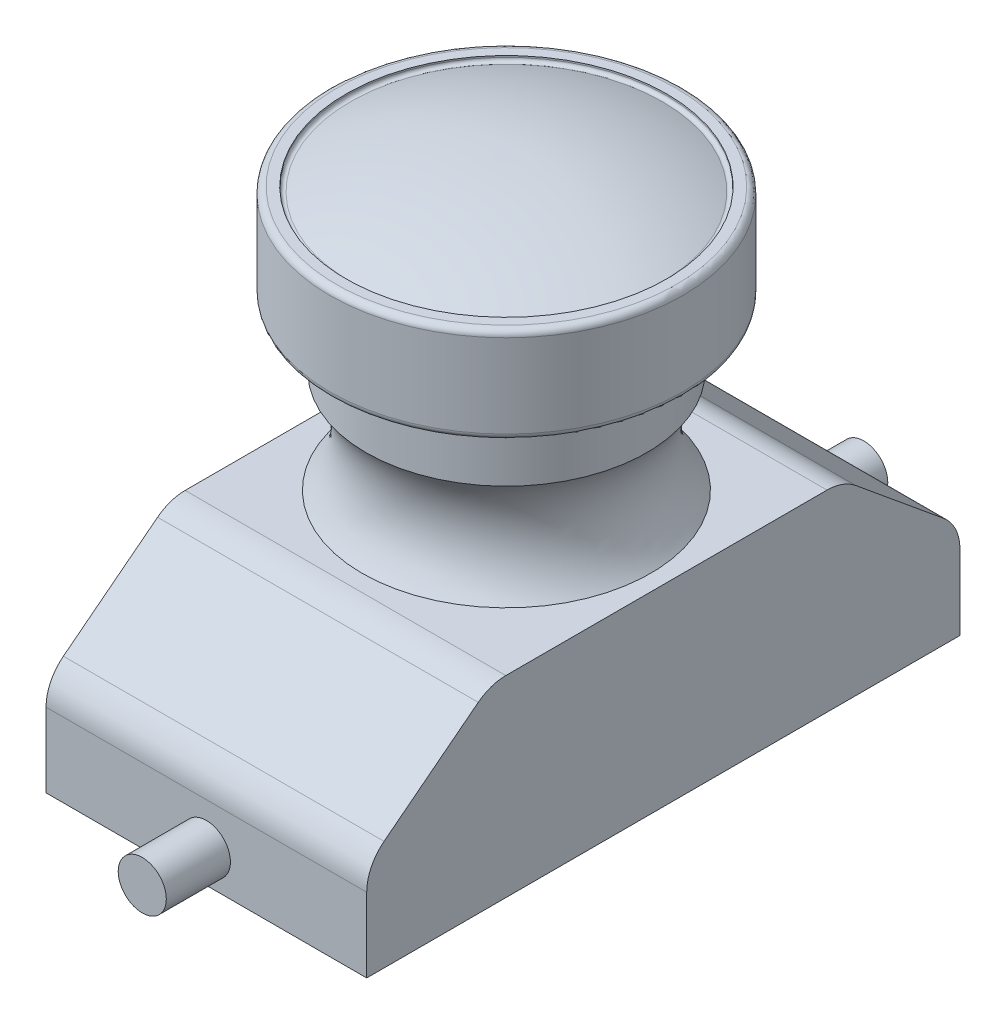
from build123d import *

# Parameters (mm, degrees)
BOSS_EXTRUDE1_DEPTH = 5
FILLET2_R           = 0.2
FILLET3_R           = 0.1
FILLET4_R           = 1.4
SKETCH5_R           = 0.75
BOSS_EXTRUDE2_DEPTH = 2
BOSS_EXTRUDE3_START = 2
SKETCH6_R           = 0.75
BOSS_EXTRUDE3_DEPTH = 2


with BuildPart() as part:
    # Sketch1 → Boss-Extrude1 (new, symmetric)
    with BuildSketch(Plane(origin=(0, 0, 0), x_dir=(0, 0, -1), z_dir=(1, 0, 0))):
        Polygon((-9.364235946, -0.006373265), (9.135764054, -0.006373265), (9.135764054, 2.993626735), (5.492417081, 5.993626735), (-5.507582919, 5.993626735), (-9.364235946, 2.993626735), align=None)
    extrude(amount=BOSS_EXTRUDE1_DEPTH, both=True)

    # Sketch3 → Revolve1 (revolve)
    with BuildSketch(Plane(origin=(0, 0, 0), x_dir=(0, 0, -1), z_dir=(1, 0, 0)), mode=Mode.PRIVATE) as revolve1_sk:
        with BuildLine():
            Line((-0.007582919, 5.993626735), (-0.007582919, 13.993626735))
            Line((-0.007582919, 13.993626735), (-5.007582919, 13.993626735))
            Line((-5.007582919, 13.993626735), (-5.007582919, 14.193626735))
            Line((-5.007582919, 14.193626735), (-5.507582919, 14.193626735))
            Line((-5.507582919, 14.193626735), (-5.507582919, 11.193626735))
            Line((-5.507582919, 11.193626735), (-4.388427411, 11.193626735))
            Line((-4.388427411, 11.193626735), (-4.388427411, 9.193626735))
            ThreePointArc((-4.388427411, 9.193626735), (-3.86841998, 7.572045246), (-4.507582919, 5.993626735))
            Line((-4.507582919, 5.993626735), (-0.007582919, 5.993626735))
        make_face()
    revolve(revolve1_sk.sketch.rotate(Axis((0, 5.993626735, 0.007582919), (0, 1, 0)), 180), axis=Axis((0, 5.993626735, 0.007582919), (0, 1, 0)))

    # Sketch4 → Revolve2 (revolve)
    with BuildSketch(Plane(origin=(0, 0, 0), x_dir=(0, 0, -1), z_dir=(1, 0, 0))):
        with BuildLine():
            Line((-0.007582919, 14.193626735), (-0.007582919, 14.993626735))
            ThreePointArc((-0.007582919, 14.993626735), (2.546145175, 14.762267206), (4.992417081, 13.993626735))
            Line((4.992417081, 13.993626735), (-0.007582919, 13.993626735))
            Line((-0.007582919, 13.993626735), (-0.007582919, 14.193626735))
        make_face()
    revolve(axis=Axis((0, 14.193626735, 0.007582919), (0, 1, 0)))

    # Fillet2
    fillet2_edges = [part.edges().sort_by_distance(p)[0] for p in [
        (0, 11.193626735, 5.507582919),
        (0, 14.193626735, 5.507582919),
    ]]
    fillet(fillet2_edges, radius=FILLET2_R)

    # Fillet3
    fillet3_edges = [part.edges().sort_by_distance(p)[0] for p in [
        (0, 13.993626735, 5.007582919),
    ]]
    fillet(fillet3_edges, radius=FILLET3_R)

    # Fillet4
    fillet4_edges = [part.edges().sort_by_distance(p)[0] for p in [
        (0, 5.993626735, -5.492417081),
        (0, 2.993626735, -9.135764054),
        (0, 2.993626735, 9.364235946),
        (0, 5.993626735, 5.507582919),
    ]]
    fillet(fillet4_edges, radius=FILLET4_R)

    # Sketch5 → Boss-Extrude2 (add)
    with BuildSketch(Plane.XY.offset(9.364235946)):
        with Locations(Location((0, 1, 0), (0, 0, 180))):
            Circle(SKETCH5_R)
    extrude(amount=BOSS_EXTRUDE2_DEPTH)

    # Sketch6 → Boss-Extrude3 (add)
    with BuildSketch(Plane(origin=(0, 0, -9.135764054), x_dir=(-1, 0, 0), z_dir=(0, 0, -1)).offset(BOSS_EXTRUDE3_START)):
        with Locations((0, 1)):
            Circle(SKETCH6_R)
    boss_extrude3 = extrude(amount=-BOSS_EXTRUDE3_DEPTH)

    # Mirror4: Boss-Extrude3 across plane
    add(boss_extrude3.mirror(Plane.XY))


solid = part.part
